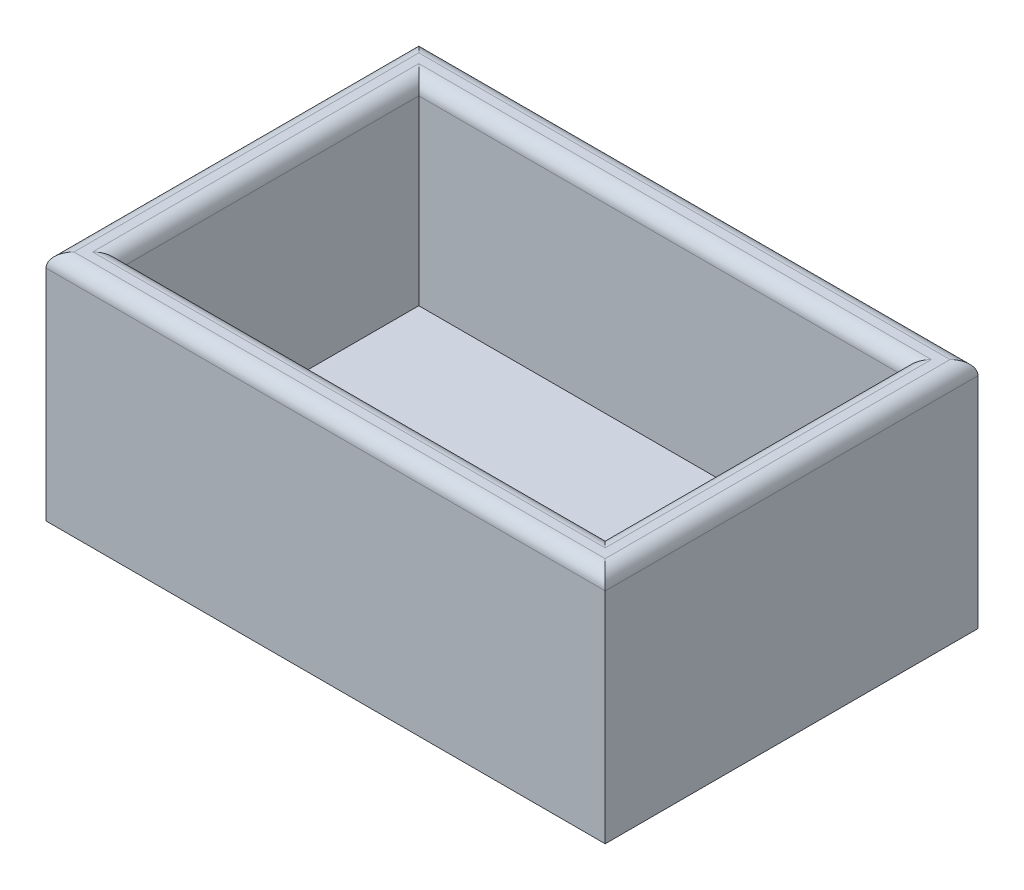
from build123d import *

# Parameters (mm, degrees)
SKETCH_1_W          = 120
SKETCH_1_H          = 80
EXTRUDE_1_DEPTH     = 50
SKETCH_2_W          = 104
SKETCH_2_H          = 64
CUT_EXTRUDE_1_DEPTH = 42
FILLET_1_R          = 3


with BuildPart() as part:
    # 草图1 → 凸台-拉伸1 (new body)
    with BuildSketch(Plane(origin=(0, 0, 0), x_dir=(1, 0, 0), z_dir=(0, 1, 0))):
        Rectangle(SKETCH_1_W, SKETCH_1_H)
    extrude(amount=EXTRUDE_1_DEPTH)

    # 草图2 → 切除-拉伸1 (cut)
    with BuildSketch(Plane(origin=(0, 50, 0), x_dir=(1, 0, 0), z_dir=(0, 1, 0))):
        Rectangle(SKETCH_2_W, SKETCH_2_H)
    extrude(amount=-CUT_EXTRUDE_1_DEPTH, mode=Mode.SUBTRACT)

    # 圆角1
    fillet_1_edges = [part.edges().sort_by_distance(p)[0] for p in [
        (60, 50, 0),
        (0, 50, -40),
        (-52, 50, 0),
        (0, 50, 32),
        (52, 50, 0),
        (0, 50, -32),
        (-60, 50, 0),
        (0, 50, 40),
    ]]
    fillet(fillet_1_edges, radius=FILLET_1_R)


solid = part.part
